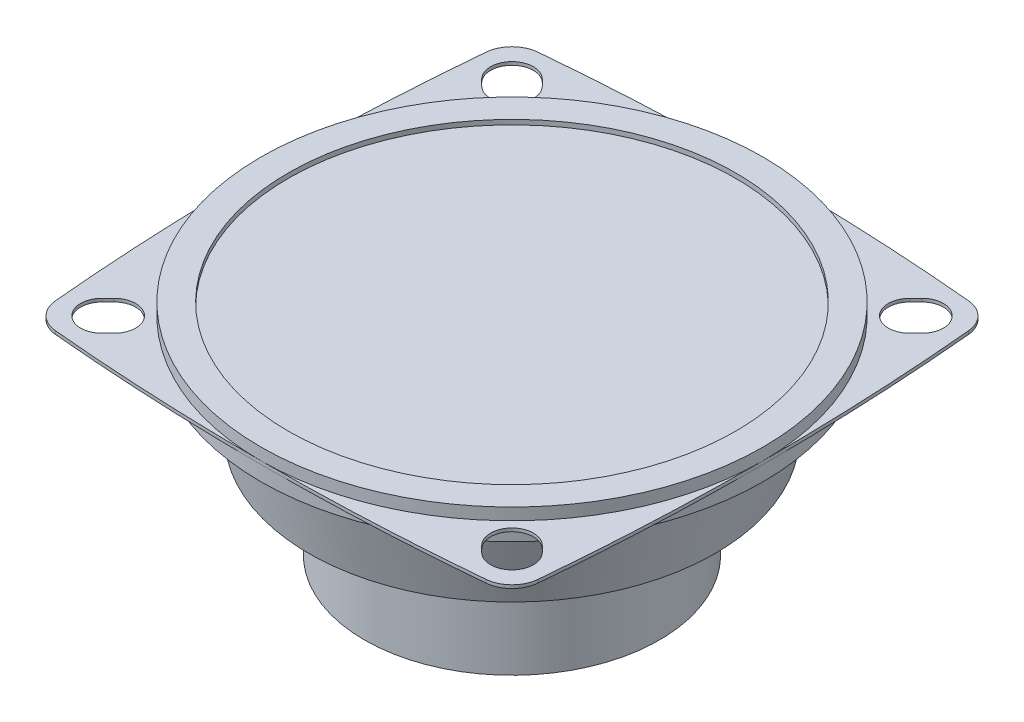
from build123d import *

# Parameters (mm, degrees)
BOSS_EXTRUDE1_DEPTH = 0.34
FILLET1_R           = 3
SKETCH3_R           = 23.5
CUT_EXTRUDE1_DEPTH  = 0.5


with BuildPart() as part:
    # Sketch1 → Revolve1 (revolve)
    with BuildSketch(Plane.XY, mode=Mode.PRIVATE) as revolve1_sk:
        Polygon((0, 0), (0, 23), (26.38, 23), (26.38, 19.84), (23.325, 19.84), (21.35, 10.8), (15.5, 9), (15.5, 0), align=None)
    revolve(revolve1_sk.sketch.rotate(Axis((0, 0, 0), (0, 1, 0)), 90), axis=Axis((0, 0, 0), (0, 1, 0)))

    # Sketch2 → Boss-Extrude1 (add)
    with BuildSketch(Plane(origin=(0, 21.75, 0), x_dir=(1, 0, 0), z_dir=(0, 1, 0))):
        with BuildLine():
            ThreePointArc((25.102290732, -25.102290732), (26.38, 0), (25.102290732, 25.102290732))
            ThreePointArc((25.102290732, 25.102290732), (0, 26.38), (-25.102290732, 25.102290732))
            ThreePointArc((-25.102290732, 25.102290732), (-26.38, 0), (-25.102290732, -25.102290732))
            ThreePointArc((-25.102290732, -25.102290732), (0, -26.38), (25.102290732, -25.102290732))
        make_face()
        with BuildLine():
            Line((-19.940411229, 23.122391745), (-19.304015126, 22.485995642))
            ThreePointArc((-19.304015126, 22.485995642), (-19.304015126, 19.304015126), (-22.485995642, 19.304015126))
            Line((-22.485995642, 19.304015126), (-23.122391745, 19.940411229))
            ThreePointArc((-23.122391745, 19.940411229), (-23.122391745, 23.122391745), (-19.940411229, 23.122391745))
        make_face(mode=Mode.SUBTRACT)
        with BuildLine():
            Line((23.122391745, 19.940411229), (22.485995642, 19.304015126))
            ThreePointArc((22.485995642, 19.304015126), (19.304015126, 19.304015126), (19.304015126, 22.485995642))
            Line((19.304015126, 22.485995642), (19.940411229, 23.122391745))
            ThreePointArc((19.940411229, 23.122391745), (23.122391745, 23.122391745), (23.122391745, 19.940411229))
        make_face(mode=Mode.SUBTRACT)
        with BuildLine():
            Line((19.940411229, -23.122391745), (19.304015126, -22.485995642))
            ThreePointArc((19.304015126, -22.485995642), (19.304015126, -19.304015126), (22.485995642, -19.304015126))
            Line((22.485995642, -19.304015126), (23.122391745, -19.940411229))
            ThreePointArc((23.122391745, -19.940411229), (23.122391745, -23.122391745), (19.940411229, -23.122391745))
        make_face(mode=Mode.SUBTRACT)
        with BuildLine():
            Line((-23.122391745, -19.940411229), (-22.485995642, -19.304015126))
            ThreePointArc((-22.485995642, -19.304015126), (-19.304015126, -19.304015126), (-19.304015126, -22.485995642))
            Line((-19.304015126, -22.485995642), (-19.940411229, -23.122391745))
            ThreePointArc((-19.940411229, -23.122391745), (-23.122391745, -23.122391745), (-23.122391745, -19.940411229))
        make_face(mode=Mode.SUBTRACT)
    extrude(amount=-BOSS_EXTRUDE1_DEPTH)

    # Fillet1
    fillet1_edges = [part.edges().sort_by_distance(p)[0] for p in [
        (-25.102290732, 21.58, 25.102290732),
        (-25.102290732, 21.58, -25.102290732),
        (25.102290732, 21.58, -25.102290732),
        (25.102290732, 21.58, 25.102290732),
    ]]
    fillet(fillet1_edges, radius=FILLET1_R)

    # Sketch3 → Cut-Extrude1 (cut)
    with BuildSketch(Plane(origin=(0, 23, 0), x_dir=(1, 0, 0), z_dir=(0, 1, 0))):
        with Locations(Location((0, 0, 0), (0, 0, 270))):
            Circle(SKETCH3_R)
    extrude(amount=-CUT_EXTRUDE1_DEPTH, mode=Mode.SUBTRACT)


solid = part.part
